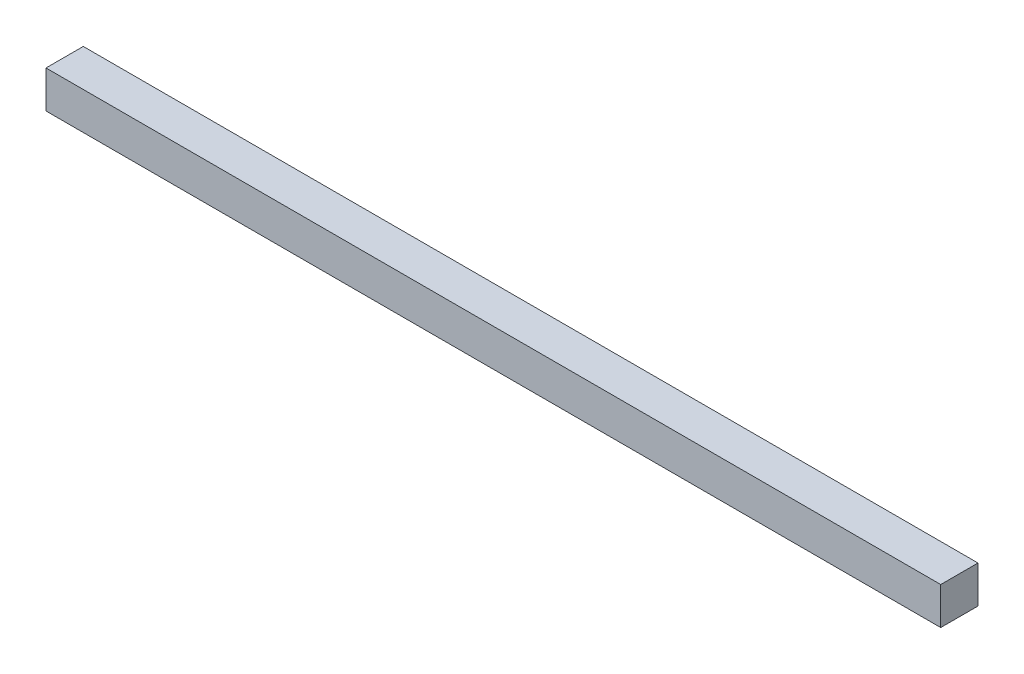
from build123d import *

# Parameters (mm, degrees)
SKETCH1_W      = 914.4
SKETCH1_H      = 38.1
EXTRUDE1_DEPTH = 38.1


with BuildPart() as part:
    # Sketch1 → Extrude1 (new body)
    with BuildSketch(Plane(origin=(0, 0, 0), x_dir=(1, 0, 0), z_dir=(0, 1, 0))):
        with Locations((457.2, 19.05)):
            Rectangle(SKETCH1_W, SKETCH1_H)
    extrude(amount=EXTRUDE1_DEPTH)


solid = part.part
